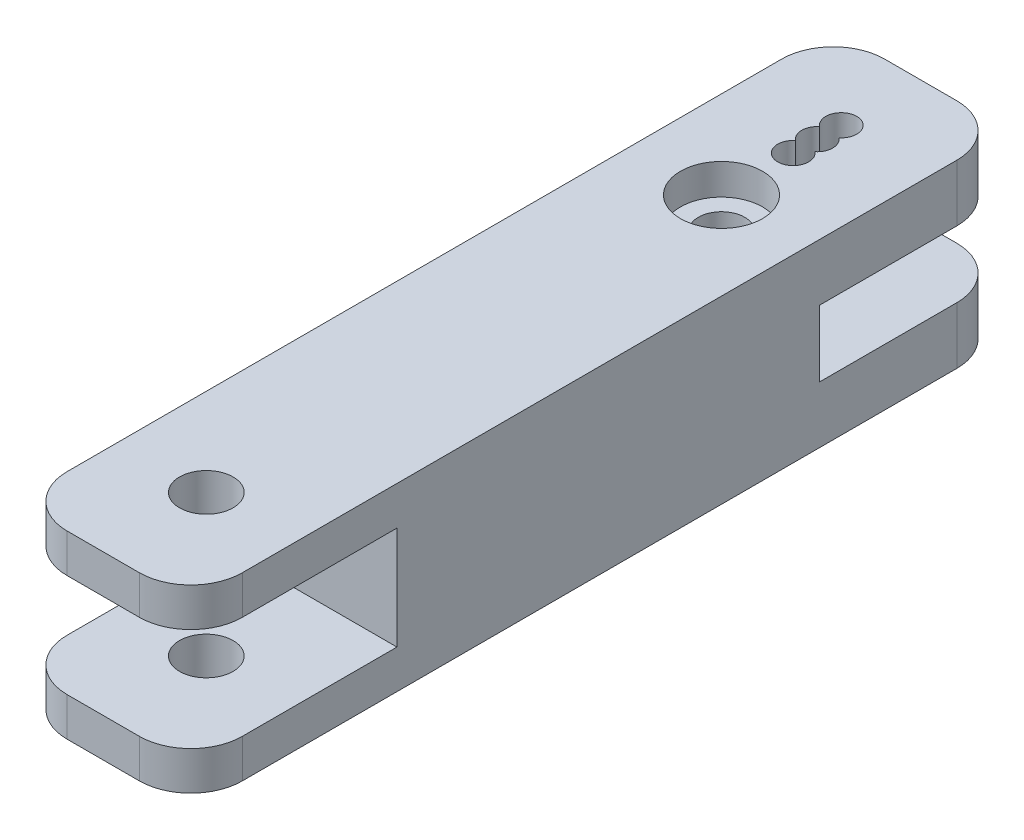
from build123d import *

# Parameters (mm, degrees)
SKETCH1_W                = 17
SKETCH1_H                = 79.3333
SKETCH1_R                = 2.6
SKETCH1_R_2              = 3.985
BOSS_EXTRUDE1_DEPTH      = 17.5
FILLET1_R                = 5
BOSS_EXTRUDE2_DEPTH      = 5.75
BOSS_EXTRUDE2_DEPTH_BACK = 5.75
SKETCH3_R                = 3.985
SKETCH3_R_2              = 2.25
SKETCH2_W                = 40
SKETCH2_H                = 10
SKETCH2_W_2              = 36.666864
SKETCH2_H_2              = 6.45
CUT_EXTRUDE2_DEPTH       = 84.000135475


with BuildPart() as part:
    # Sketch1 → Boss-Extrude1 (new body)
    with BuildSketch(Plane(origin=(0, 0, 0), x_dir=(1, 0, 0), z_dir=(0, 1, 0))):
        with Locations((8.5, 39.66665)):
            Rectangle(SKETCH1_W, SKETCH1_H)
        with Locations(Location((8.5, 10, 0), (0, 0, 270))):
            Circle(SKETCH1_R, mode=Mode.SUBTRACT)
        with Locations(Location((8.5, 60, 0), (0, 0, 270))):
            Circle(SKETCH1_R_2, mode=Mode.SUBTRACT)
        with BuildLine():
            ThreePointArc((7.51420262, 70.4998675), (6.957011868, 69.333201), (7.51420262, 68.1665345))
            ThreePointArc((7.51420262, 68.1665345), (8.457011868, 65.499868), (9.399821116, 68.1665345))
            ThreePointArc((9.399821116, 68.1665345), (9.957011868, 69.333201), (9.399821116, 70.4998675))
            ThreePointArc((9.399821116, 70.4998675), (8.457011868, 73.166534), (7.51420262, 70.4998675))
        make_face(mode=Mode.SUBTRACT)
    extrude(amount=BOSS_EXTRUDE1_DEPTH)

    # Fillet1
    fillet1_edges = [part.edges().sort_by_distance(p)[0] for p in [
        (0, 8.75, -79.3333),
        (17, 8.75, -79.3333),
        (17, 8.75, 0),
        (0, 8.75, 0),
    ]]
    fillet(fillet1_edges, radius=FILLET1_R)

    # Sketch3 → Boss-Extrude2 (add, two sides: drawn at the far end of the back side and taken through both)
    with BuildSketch(Plane(origin=(0, 8.75, 0), x_dir=(1, 0, 0), z_dir=(0, 1, 0)).offset(-BOSS_EXTRUDE2_DEPTH_BACK)):
        with Locations(Location((8.5, 60, 0), (0, 0, 90))):
            Circle(SKETCH3_R)
        with Locations(Location((8.5, 60, 0), (0, 0, 90))):
            Circle(SKETCH3_R_2, mode=Mode.SUBTRACT)
    extrude(amount=BOSS_EXTRUDE2_DEPTH + BOSS_EXTRUDE2_DEPTH_BACK)

    # Sketch2 → Cut-Extrude2 (cut, through all)
    with BuildSketch(Plane(origin=(17, 0, 0), x_dir=(0, 0, -1), z_dir=(1, 0, 0))):
        with Locations((0, 8.75)):
            Rectangle(SKETCH2_W, SKETCH2_H)
        with Locations((79.3333, 8.75)):
            Rectangle(SKETCH2_W_2, SKETCH2_H_2)
    extrude(amount=-CUT_EXTRUDE2_DEPTH, mode=Mode.SUBTRACT)


solid = part.part
